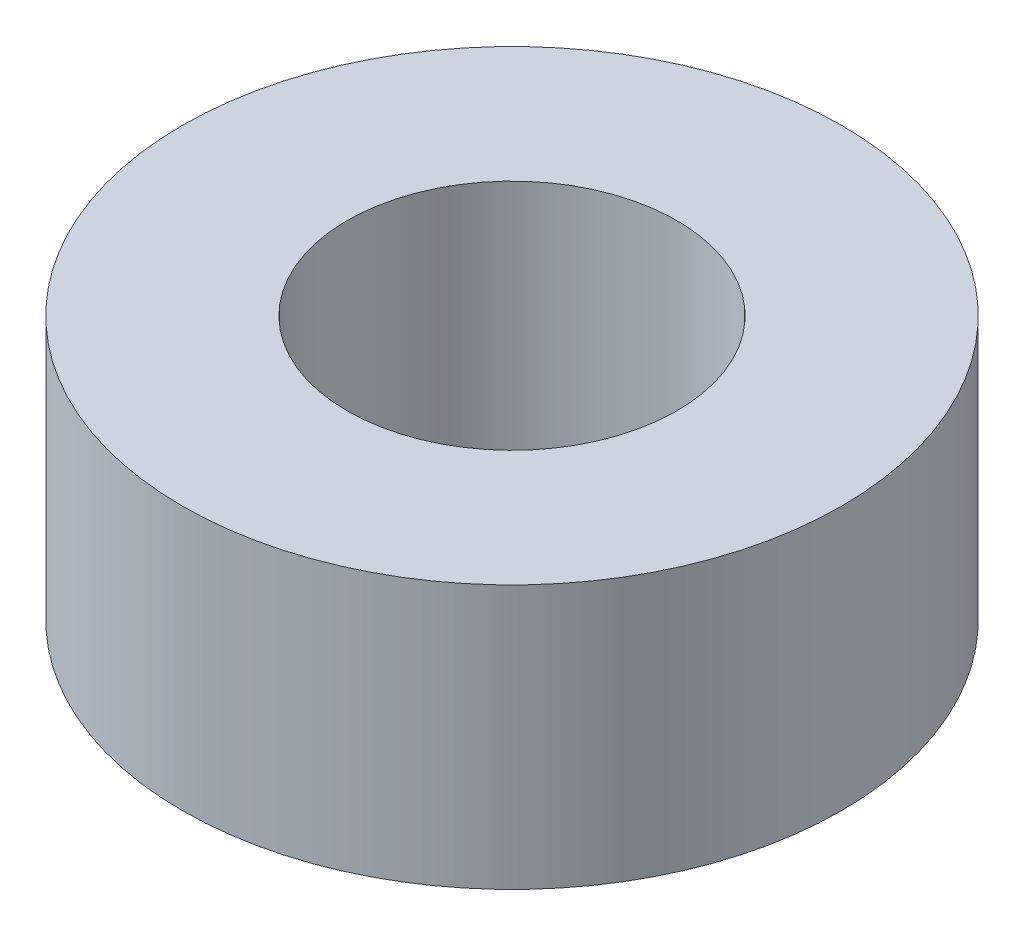
from build123d import *

# Parameters (mm, degrees)
CROQUIS1_R              = 5
CROQUIS1_R_2            = 2.5
SALIENTE_EXTRUIR1_DEPTH = 4


with BuildPart() as part:
    # Croquis1 → Saliente-Extruir1 (new body)
    with BuildSketch(Plane(origin=(0, 0, 0), x_dir=(1, 0, 0), z_dir=(0, 1, 0))):
        with Locations(Location((0, 0, 0), (0, 0, 270))):
            Circle(CROQUIS1_R)
        with Locations(Location((0, 0, 0), (0, 0, 270))):
            Circle(CROQUIS1_R_2, mode=Mode.SUBTRACT)
    extrude(amount=SALIENTE_EXTRUIR1_DEPTH)


solid = part.part
